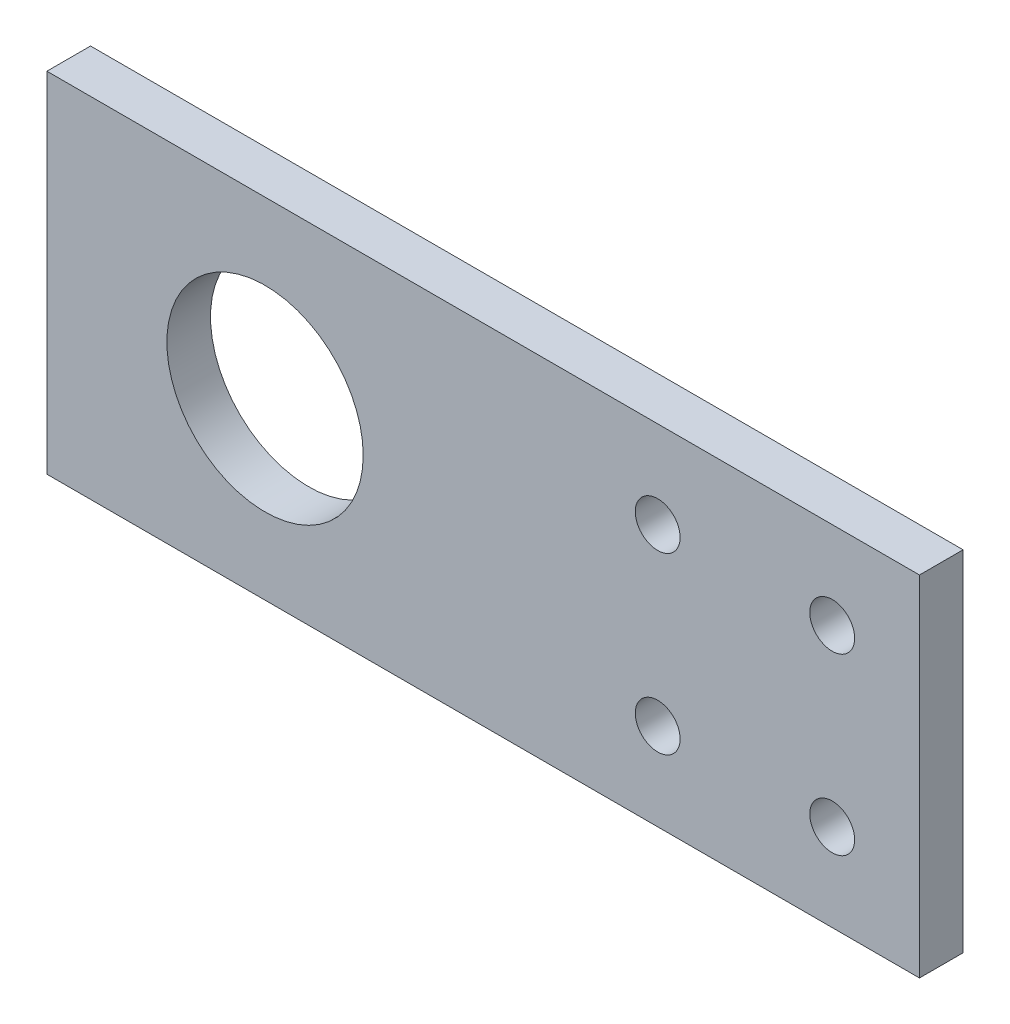
from build123d import *

# Parameters (mm, degrees)
SKETCH1_W           = 127
SKETCH1_H           = 50.8
SKETCH1_R           = 3.2639
BOSS_EXTRUDE1_DEPTH = 3.175
SKETCH2_R           = 14.2875
CUT_EXTRUDE1_DEPTH  = 137.930502446


with BuildPart() as part:
    # Sketch1 → Boss-Extrude1 (new, symmetric)
    with BuildSketch(Plane.XY):
        with Locations((63.5, 25.4)):
            Rectangle(SKETCH1_W, SKETCH1_H)
        with Locations((88.9, 12.7)):
            Circle(SKETCH1_R, mode=Mode.SUBTRACT)
        with Locations((114.3, 12.7)):
            Circle(SKETCH1_R, mode=Mode.SUBTRACT)
        with Locations((88.9, 38.1)):
            Circle(SKETCH1_R, mode=Mode.SUBTRACT)
        with Locations((114.3, 38.1)):
            Circle(SKETCH1_R, mode=Mode.SUBTRACT)
    extrude(amount=BOSS_EXTRUDE1_DEPTH, both=True)

    # Sketch2 → Cut-Extrude1 (cut, through all)
    with BuildSketch(Plane.XY.offset(3.175)):
        with Locations((31.75, 25.4)):
            Circle(SKETCH2_R)
    extrude(amount=-CUT_EXTRUDE1_DEPTH, mode=Mode.SUBTRACT)


solid = part.part
